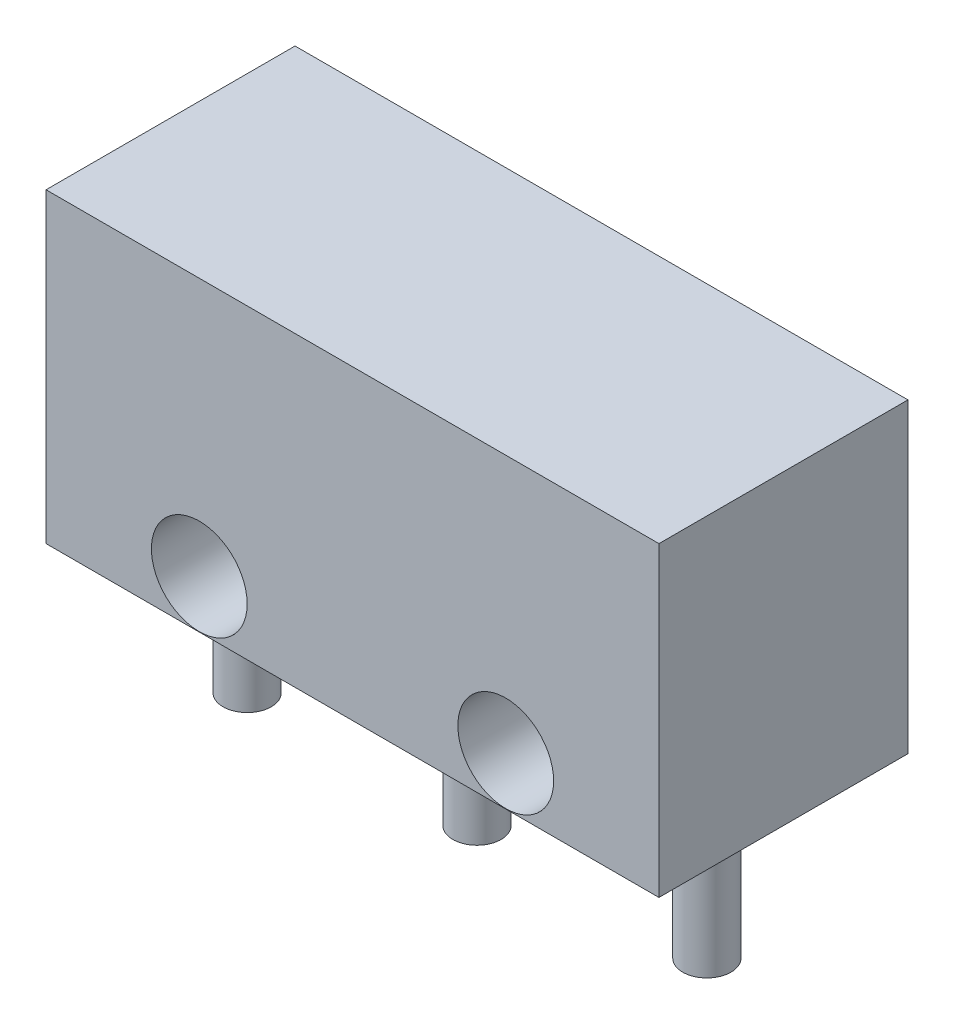
from build123d import *

# Parameters (mm, degrees)
SKETCH1_W           = 12.7
SKETCH1_H           = 5.159375
BOSS_EXTRUDE1_DEPTH = 6.35
SKETCH2_R           = 0.5
BOSS_EXTRUDE2_DEPTH = 3.175
SKETCH3_R           = 0.9921875
CUT_EXTRUDE1_DEPTH  = 16.107337634


with BuildPart() as part:
    # Sketch1 → Boss-Extrude1 (new body)
    with BuildSketch(Plane(origin=(0, 0, 0), x_dir=(1, 0, 0), z_dir=(0, 1, 0))):
        with Locations((6.35, 2.5796875)):
            Rectangle(SKETCH1_W, SKETCH1_H)
    extrude(amount=BOSS_EXTRUDE1_DEPTH)

    # Sketch2 → Boss-Extrude2 (add)
    with BuildSketch(Plane.XZ):
        with Locations(Location((6.35, -2.5796875, 0), (0, 0, 270))):
            Circle(SKETCH2_R)
        with Locations(Location((1.5875, -2.5796875, 0), (0, 0, 270))):
            Circle(SKETCH2_R)
        with Locations(Location((11.1125, -2.5796875, 0), (0, 0, 270))):
            Circle(SKETCH2_R)
    extrude(amount=BOSS_EXTRUDE2_DEPTH)

    # Sketch3 → Cut-Extrude1 (cut, through all)
    with BuildSketch(Plane.XY):
        with Locations((9.525, 1)):
            Circle(SKETCH3_R)
        with Locations((3.175, 1)):
            Circle(SKETCH3_R)
    extrude(amount=-CUT_EXTRUDE1_DEPTH, mode=Mode.SUBTRACT)


solid = part.part
